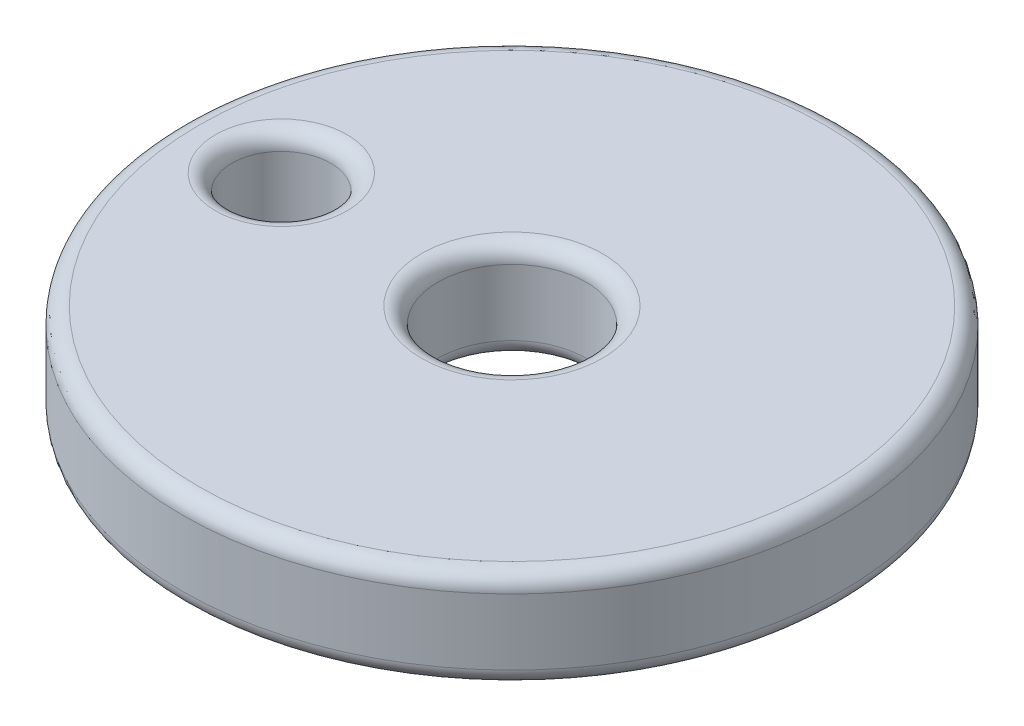
from build123d import *

# Parameters (mm, degrees)
SKETCH1_R           = 10
SKETCH1_R_2         = 2.25
SKETCH1_R_3         = 1.5
BOSS_EXTRUDE1_DEPTH = 3
FILLET1_R           = 0.5


with BuildPart() as part:
    # Sketch1 → Boss-Extrude1 (new body)
    with BuildSketch(Plane(origin=(0, 0, 0), x_dir=(1, 0, 0), z_dir=(0, 1, 0))):
        with Locations(Location((0, 0, 0), (0, 0, 270))):
            Circle(SKETCH1_R)
        with Locations(Location((0, 0, 0), (0, 0, 270))):
            Circle(SKETCH1_R_2, mode=Mode.SUBTRACT)
        with Locations(Location((-7, 0, 0), (0, 0, 270))):
            Circle(SKETCH1_R_3, mode=Mode.SUBTRACT)
    extrude(amount=BOSS_EXTRUDE1_DEPTH)

    # Fillet1
    fillet1_edges = [part.edges().sort_by_distance(p)[0] for p in [
        (0, 0, -10),
        (0, 3, -10),
        (0, 0, -2.25),
        (0, 3, -2.25),
        (-7, 0, -1.5),
        (-7, 3, -1.5),
    ]]
    fillet(fillet1_edges, radius=FILLET1_R)


solid = part.part
